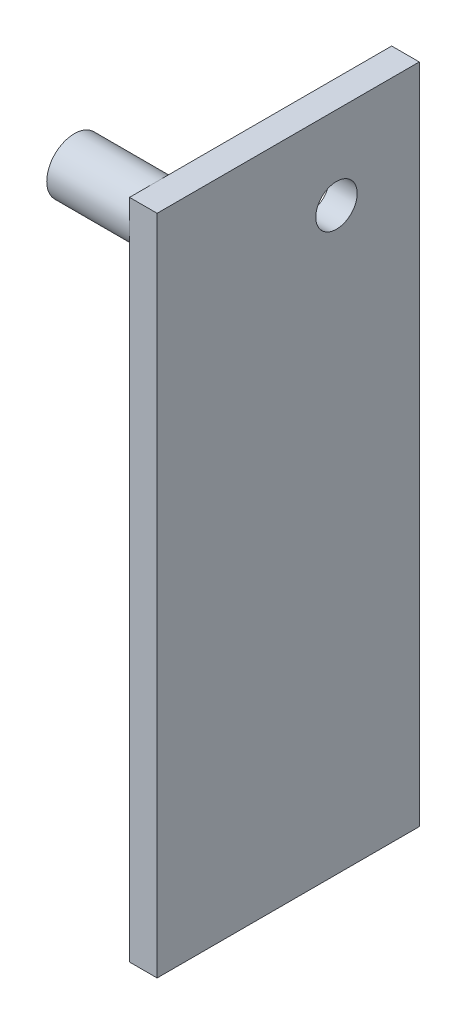
from build123d import *

# Parameters (mm, degrees)
SKETCH1_W           = 48
SKETCH1_H           = 19
BOSS_EXTRUDE1_DEPTH = 2
SKETCH2_R           = 2
SKETCH2_R_2         = 1
BOSS_EXTRUDE2_DEPTH = 6
CUT_EXTRUDE1_REACH  = 53.971
SKETCH3_R           = 1.5


with BuildPart() as part:
    # Sketch1 → Boss-Extrude1 (new body)
    with BuildSketch(Plane.YZ):
        with Locations((24, 9.5)):
            Rectangle(SKETCH1_W, SKETCH1_H)
    extrude(amount=BOSS_EXTRUDE1_DEPTH)

    # Sketch2 → Boss-Extrude2 (add)
    # profile 1 of 2: a face of its own
    with BuildSketch(Plane(origin=(0, 0, 0), x_dir=(0, -1, 0), z_dir=(-1, 0, 0))):
        with Locations(Location((-46, 17, 0), (0, 0, 90))):
            Circle(SKETCH2_R)
        with Locations(Location((-46, 17, 0), (0, 0, 90))):
            Circle(SKETCH2_R_2, mode=Mode.SUBTRACT)
    # profile 2 of 2: a face of its own
    with BuildSketch(Plane(origin=(0, 0, 0), x_dir=(0, -1, 0), z_dir=(-1, 0, 0))):
        with Locations(Location((-2, 2, 0), (0, 0, 270))):
            Circle(SKETCH2_R)
        with Locations(Location((-2, 2, 0), (0, 0, 90))):
            Circle(SKETCH2_R_2, mode=Mode.SUBTRACT)
    extrude(amount=BOSS_EXTRUDE2_DEPTH)

    # Sketch3 → Cut-Extrude1 (cut, up to next)
    with BuildSketch(Plane(origin=(0, 0, 0), x_dir=(0, -1, 0), z_dir=(-1, 0, 0)), mode=Mode.PRIVATE) as cut_extrude1_sk1:
        with Locations(Location((-42, 6, 0), (0, 0, 90))):
            Circle(SKETCH3_R)
    cut_extrude1_tool1 = extrude(cut_extrude1_sk1.sketch, amount=-CUT_EXTRUDE1_REACH, mode=Mode.PRIVATE) & part.part
    add(cut_extrude1_tool1.solids().sort_by_distance((0, 42, 6))[0], mode=Mode.SUBTRACT)


solid = part.part
